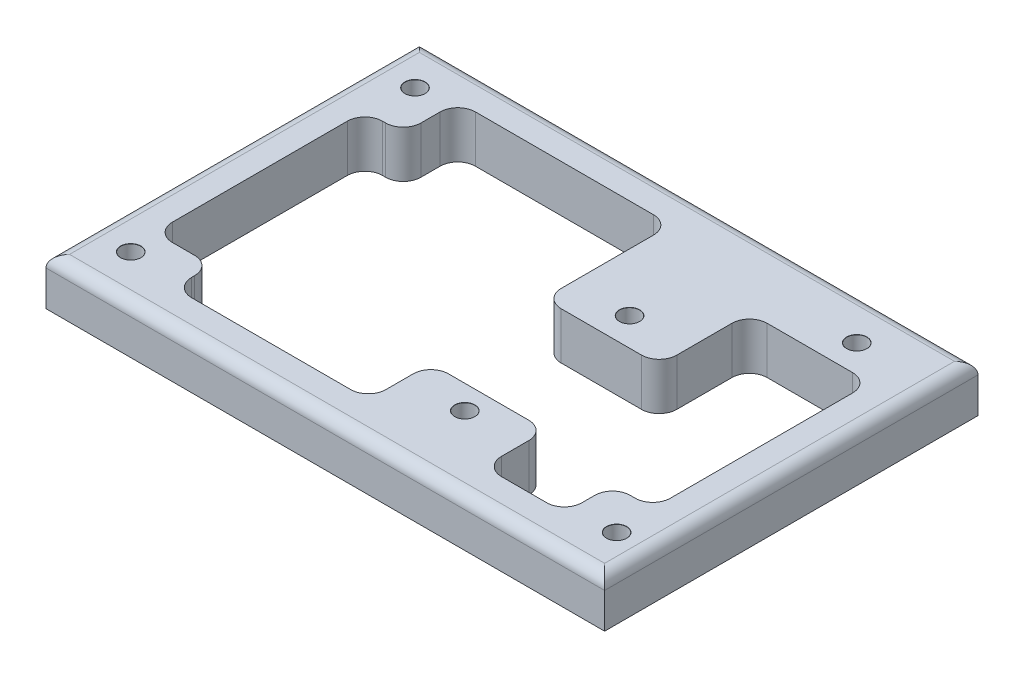
from build123d import *

# Parameters (mm, degrees)
SKETCH2_W                      = 95
SKETCH2_H                      = 63.5
BOSS_EXTRUDE1_DEPTH            = 8
M3_CLEARANCE_HOLE1_D           = 3.4
M3_CLEARANCE_HOLE1_CSINK_D     = 3.45
M3_CLEARANCE_HOLE1_CSINK_ANGLE = 90
CUT_EXTRUDE1_DEPTH             = 10
CUT_EXTRUDE2_DEPTH             = 2.4
FILLET2_R                      = 2


with BuildPart() as part:
    # Sketch2 → Boss-Extrude1 (new body)
    with BuildSketch(Plane(origin=(0, 0, 0), x_dir=(1, 0, 0), z_dir=(0, 1, 0))):
        Rectangle(SKETCH2_W, SKETCH2_H)
    extrude(amount=BOSS_EXTRUDE1_DEPTH)

    # M3 Clearance Hole1 (through all)
    with Locations(Plane(origin=(0, 8, 0), x_dir=(1, 0, 0), z_dir=(0, 1, 0))):
        with Locations((-40.666732268, 24.17), (-40.666732268, -24.17), (34.463267732, 24.17), (41.963267732, -24.17), (11.143267732, -19.17), (11.143267732, 8.85)):
            CounterSinkHole(M3_CLEARANCE_HOLE1_D / 2, M3_CLEARANCE_HOLE1_CSINK_D / 2, counter_sink_angle=M3_CLEARANCE_HOLE1_CSINK_ANGLE)

    # Sketch9 → Cut-Extrude1 (cut)
    with BuildSketch(Plane(origin=(0, 8, 0), x_dir=(1, 0, 0), z_dir=(0, 1, 0))):
        with BuildLine():
            Line((-34.974163292, 19.487383717), (-34.974163292, 22.75))
            ThreePointArc((-34.974163292, 22.75), (-34.095483636, 24.871320344), (-31.974163292, 25.75))
            Line((-31.974163292, 25.75), (-1.684765082, 25.75))
            ThreePointArc((-1.684765082, 25.75), (0.436555262, 24.871320344), (1.315234918, 22.75))
            Line((1.315234918, 22.75), (1.315234918, 7.055031971))
            ThreePointArc((1.315234918, 7.055031971), (2.193914574, 4.933711628), (4.315234918, 4.055031971))
            Line((4.315234918, 4.055031971), (17.971300546, 4.055031971))
            ThreePointArc((17.971300546, 4.055031971), (20.09262089, 4.933711628), (20.971300546, 7.055031971))
            Line((20.971300546, 7.055031971), (20.971300546, 16.428287462))
            ThreePointArc((20.971300546, 16.428287462), (21.849980203, 18.549607805), (23.971300546, 19.428287462))
            Line((23.971300546, 19.428287462), (38.5, 19.428287462))
            ThreePointArc((38.5, 19.428287462), (40.621320344, 18.549607805), (41.5, 16.428287462))
            Line((41.5, 16.428287462), (41.5, -14.560508757))
            ThreePointArc((41.5, -14.560508757), (40.621320344, -16.681829101), (38.5, -17.560508757))
            Line((38.5, -17.560508757), (37.647901029, -17.560508757))
            ThreePointArc((37.647901029, -17.560508757), (35.526580685, -18.439188414), (34.647901029, -20.560508757))
            Line((34.647901029, -20.560508757), (34.647901029, -22.75))
            ThreePointArc((34.647901029, -22.75), (33.769221372, -24.871320344), (31.647901029, -25.75))
            Line((31.647901029, -25.75), (23.971300546, -25.75))
            ThreePointArc((23.971300546, -25.75), (21.849980203, -24.871320344), (20.971300546, -22.75))
            Line((20.971300546, -22.75), (20.971300546, -18.118028913))
            ThreePointArc((20.971300546, -18.118028913), (20.09262089, -15.996708569), (17.971300546, -15.118028913))
            Line((17.971300546, -15.118028913), (4.315234918, -15.118028913))
            ThreePointArc((4.315234918, -15.118028913), (2.193914574, -15.996708569), (1.315234918, -18.118028913))
            Line((1.315234918, -18.118028913), (1.315234918, -22.75))
            ThreePointArc((1.315234918, -22.75), (0.436555262, -24.871320344), (-1.684765082, -25.75))
            Line((-1.684765082, -25.75), (-28.730080623, -25.75))
            ThreePointArc((-28.730080623, -25.75), (-30.851400966, -24.871320344), (-31.730080623, -22.75))
            Line((-31.730080623, -22.75), (-31.730080623, -22.252488185))
            ThreePointArc((-31.730080623, -22.252488185), (-32.608760279, -20.131167841), (-34.730080623, -19.252488185))
            Line((-34.730080623, -19.252488185), (-38.5, -19.252488185))
            ThreePointArc((-38.5, -19.252488185), (-40.621320344, -18.373808528), (-41.5, -16.252488185))
            Line((-41.5, -16.252488185), (-41.5, 13.487383717))
            ThreePointArc((-41.5, 13.487383717), (-40.621320344, 15.60870406), (-38.5, 16.487383717))
            Line((-38.5, 16.487383717), (-37.974163292, 16.487383717))
            ThreePointArc((-37.974163292, 16.487383717), (-35.852842949, 17.366063373), (-34.974163292, 19.487383717))
        make_face()
    extrude(amount=-CUT_EXTRUDE1_DEPTH, mode=Mode.SUBTRACT)

    # Sketch10 → Cut-Extrude2 (cut)
    with BuildSketch(Plane.XZ):
        Polygon((-41.401711603, 20.903023001), (-38.204936861, 21.900000725), (-37.469957526, 25.166977724), (-39.931752933, 27.436976999), (-43.128527675, 26.439999275), (-43.86350701, 23.173022276), align=None)
        Polygon((-41.973397742, -27.253173474), (-38.649958452, -26.843192232), (-37.343292978, -23.760018758), (-39.360066794, -21.086826526), (-42.683506084, -21.496807768), (-43.990171558, -24.579981242), align=None)
        Polygon((8.072719548, -10.186064064), (10.765059061, -12.177204763), (13.835607245, -10.841140699), (14.213815916, -7.513935936), (11.521476403, -5.522795237), (8.450928219, -6.858859301), align=None)
        Polygon((8.080180086, 17.816919291), (10.783526176, 15.84074793), (13.846613823, 17.193828639), (14.206355378, 20.523080709), (11.503009288, 22.49925207), (8.439921642, 21.146171361), align=None)
        Polygon((32.605291512, -26.95590339), (35.94694273, -27.172006301), (37.804918951, -24.386102911), (36.321243952, -21.38409661), (32.979592734, -21.167993699), (31.121616514, -23.953897089), align=None)
        Polygon((40.040474323, 21.428431318), (43.376139153, 21.13402772), (45.298932562, 23.875596402), (43.886061141, 26.911568682), (40.550396312, 27.20597228), (38.627602903, 24.464403598), align=None)
    extrude(amount=-CUT_EXTRUDE2_DEPTH, mode=Mode.SUBTRACT)

    # Fillet2
    fillet2_edges = [part.edges().sort_by_distance(p)[0] for p in [
        (47.5, 8, 0),
        (0, 8, -31.75),
        (-47.5, 8, 0),
        (0, 8, 31.75),
    ]]
    fillet(fillet2_edges, radius=FILLET2_R)


solid = part.part
